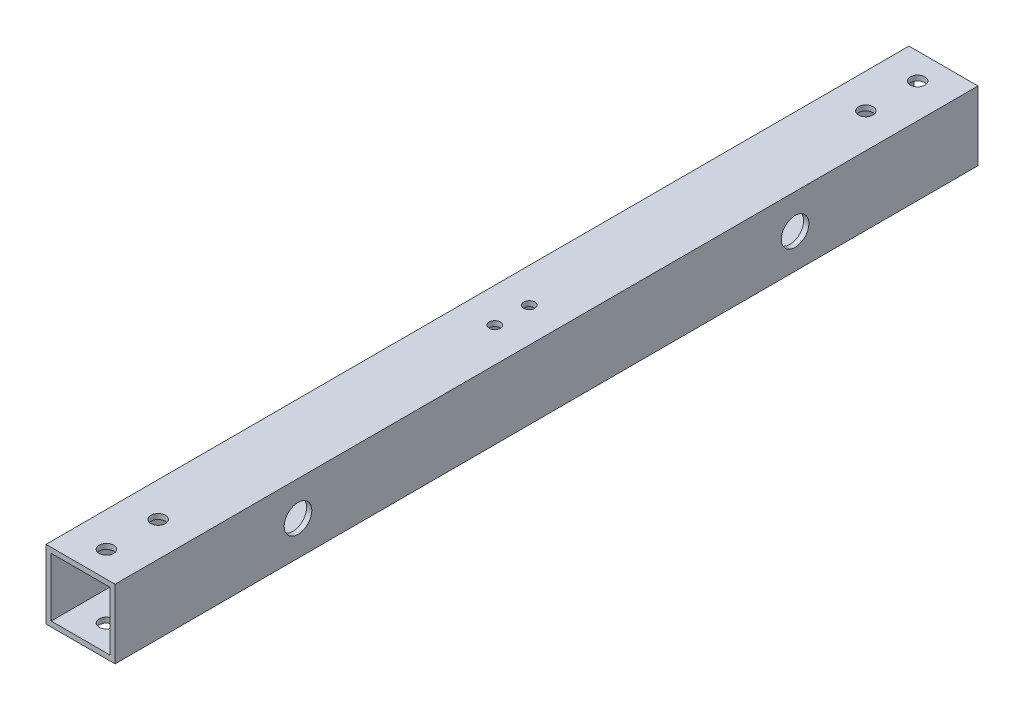
from build123d import *

# Parameters (mm, degrees)
SKETCH_1_W          = 20
SKETCH_1_H          = 20
SKETCH_1_W_2        = 17
SKETCH_1_H_2        = 17
EXTRUDE_1_DEPTH     = 250
SKETCH_2_R          = 2.1
SKETCH_2_R_2        = 1.6
CUT_EXTRUDE_1_DEPTH = 251.99800796
SKETCH_3_R          = 4
CUT_EXTRUDE_3_DEPTH = 251.99800796


with BuildPart() as part:
    # 草图1 → 凸台-拉伸1 (new body)
    with BuildSketch(Plane.XY):
        Rectangle(SKETCH_1_W, SKETCH_1_H)
        Rectangle(SKETCH_1_W_2, SKETCH_1_H_2, mode=Mode.SUBTRACT)
    extrude(amount=EXTRUDE_1_DEPTH)

    # 草图2 → 切除-拉伸1 (cut, through all)
    with BuildSketch(Plane(origin=(0, 10, 0), x_dir=(1, 0, 0), z_dir=(0, 1, 0))):
        with Locations(Location((0, -7.5, 0), (0, 0, 270))):
            Circle(SKETCH_2_R)
        with Locations(Location((0, -22.5, 0), (0, 0, 270))):
            Circle(SKETCH_2_R)
        with Locations(Location((0, -120, 0), (0, 0, 270))):
            Circle(SKETCH_2_R_2)
        with Locations((0, -130)):
            Circle(SKETCH_2_R_2)
        with Locations((0, -227.5)):
            Circle(SKETCH_2_R)
        with Locations((0, -242.5)):
            Circle(SKETCH_2_R)
    extrude(amount=-CUT_EXTRUDE_1_DEPTH, mode=Mode.SUBTRACT)

    # 草图3 → 切除-拉伸3 (cut, through all)
    with BuildSketch(Plane.ZY.offset(10)):
        with Locations((197, 0)):
            Circle(SKETCH_3_R)
        with Locations(Location((53, 0, 0), (0, 0, 270))):
            Circle(SKETCH_3_R)
    extrude(amount=-CUT_EXTRUDE_3_DEPTH, mode=Mode.SUBTRACT)


solid = part.part
